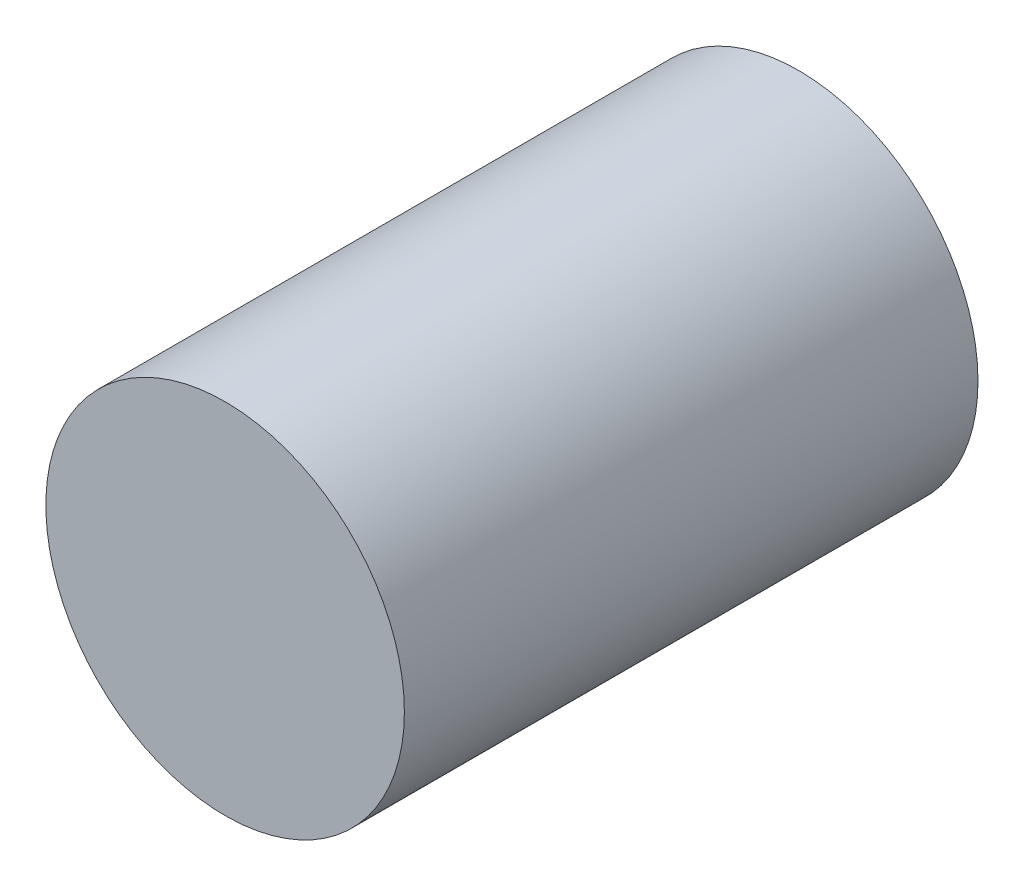
from build123d import *

# Parameters (mm, degrees)
SKETCH1_R           = 25
BOSS_EXTRUDE1_DEPTH = 80


with BuildPart() as part:
    # Sketch1 → Boss-Extrude1 (new body)
    with BuildSketch(Plane.XY):
        Circle(SKETCH1_R)
    extrude(amount=BOSS_EXTRUDE1_DEPTH)


solid = part.part
